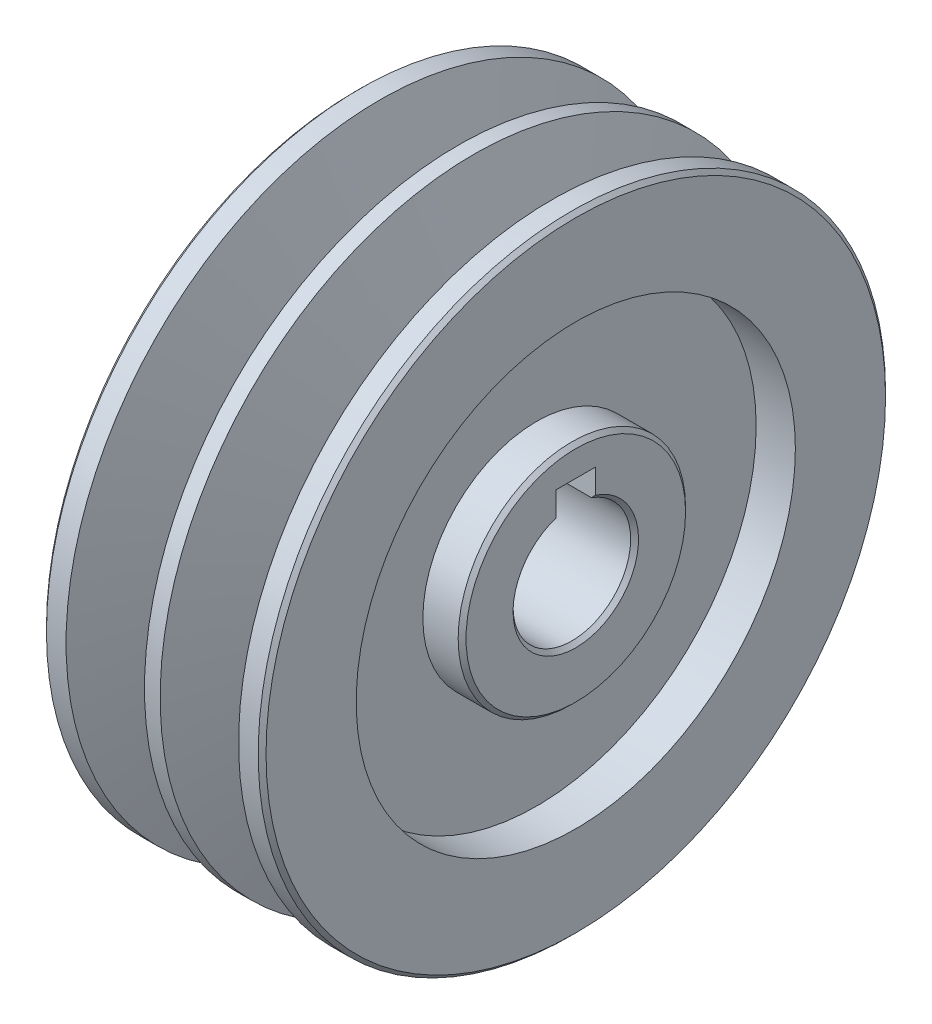
from build123d import *

# Parameters (mm, degrees)
CHAMFER1_SIZE      = 0.5
CHAMFER2_SIZE      = 0.5
FILLET2_R          = 1
CUT_EXTRUDE1_DEPTH = 64.118935352


with BuildPart() as part:
    # Sketch1 → Revolve1 (revolve)
    with BuildSketch(Plane(origin=(0, 0, 0), x_dir=(1, 0, 0), z_dir=(0, 1, 0))):
        Polygon((-14, 40), (-14, 28), (-9, 28), (-9, 14.5), (-14, 14.5), (-14, 7.5), (14, 7.5), (14, 14.5), (9, 14.5), (9, 28), (14, 28), (14, 40), (11, 40), (7.942693185, 30), (4.057306815, 30), (1, 40), (-1, 40), (-4.057306815, 30), (-7.942693185, 30), (-11, 40), align=None)
    revolve(axis=Axis((0, 0, 0), (-1, 0, 0)))

    # Chamfer1
    chamfer1_edges = [part.edges().sort_by_distance(p)[0] for p in [
        (14, 0, 7.5),
        (14, 0, 14.5),
        (14, 0, 40),
    ]]
    chamfer(chamfer1_edges, length=CHAMFER1_SIZE)

    # Chamfer2
    chamfer2_edges = [part.edges().sort_by_distance(p)[0] for p in [
        (-14, 0, 40),
        (-14, 0, 28),
        (-14, 0, 14.5),
        (-14, 0, 7.5),
    ]]
    chamfer(chamfer2_edges, length=CHAMFER2_SIZE)

    # Fillet2
    fillet2_edges = [part.edges().sort_by_distance(p)[0] for p in [
        (-9, 0, 28),
        (-9, 0, 14.5),
    ]]
    fillet(fillet2_edges, radius=FILLET2_R)

    # Sketch2 → Cut-Extrude1 (cut, through all)
    with BuildSketch(Plane(origin=(14, 0, 0), x_dir=(0, 0, -1), z_dir=(1, 0, 0))):
        Polygon((-2.5, 7.5), (-2.5, 5.832980878), (2.5, 5.832980878), (2.5, 7.5), (2.5, 10.7), (-2.5, 10.7), align=None)
    extrude(amount=-CUT_EXTRUDE1_DEPTH, mode=Mode.SUBTRACT)


solid = part.part
